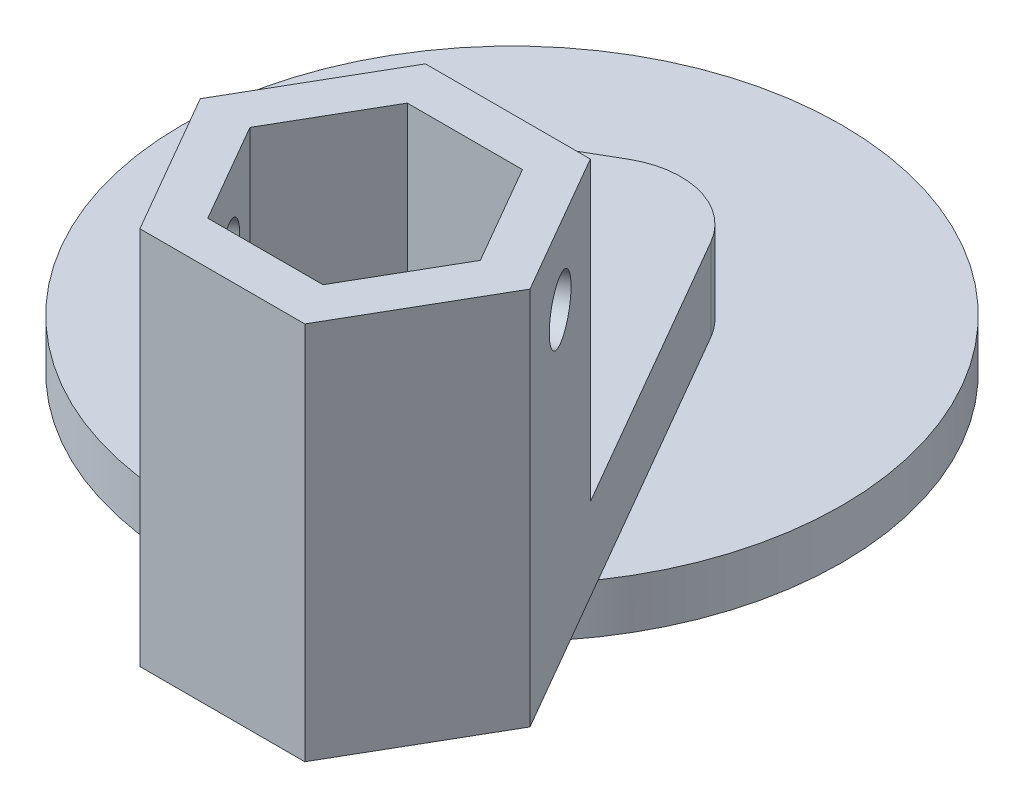
from build123d import *

# Parameters (mm, degrees)
EXTRUDE_3_DEPTH     = 18
SKETCH_2_R          = 1.8
CUT_EXTRUDE_1_DEPTH = 17.325
SKETCH_4_R          = 1.75
EXTRUDE_9_DEPTH     = 5
SKETCH_7_W          = 17.320508076
SKETCH_7_H          = 5
EXTRUDE_10_DEPTH    = 25
FILLET_1_R          = 5
FILLET_2_R          = 5
SKETCH_8_R          = 20
EXTRUDE_11_DEPTH    = 3


with BuildPart() as part:
    # 草图1 → 凸台-拉伸3 (new body)
    with BuildSketch(Plane(origin=(0, 0, 0), x_dir=(1, 0, 0), z_dir=(0, 1, 0))):
        Polygon((10, 0), (5, 8.660254038), (-5, 8.660254038), (-10, 0), (-5, -8.660254038), (5, -8.660254038), align=None)
        Polygon((6.985938257, 0), (3.492969129, 6.05), (-3.492969129, 6.05), (-6.985938257, 0), (-3.492969129, -6.05), (3.492969129, -6.05), align=None, mode=Mode.SUBTRACT)
    extrude(amount=-EXTRUDE_3_DEPTH)

    # 草图2 → 切除-拉伸1 (cut)
    with BuildSketch(Plane(origin=(7.5, 0, -4.330127019), x_dir=(-0.5000000000000003, 0, -0.8660254037844386), z_dir=(0.8660254037844386, 0, -0.5000000000000003))):
        with Locations((0, -4.5)):
            Circle(SKETCH_2_R)
    extrude(amount=-CUT_EXTRUDE_1_DEPTH, mode=Mode.SUBTRACT)

    # 草图4 → 凸台-拉伸9 (add)
    with BuildSketch(Plane.XZ.offset(18)):
        Polygon((-10, 0), (5, -8.660254038), (10, 0), (5, 8.660254038), (-5, 8.660254038), align=None)
        with Locations(Location((0, 0, 0), (0, 0, 270))):
            Circle(SKETCH_4_R, mode=Mode.SUBTRACT)
    extrude(amount=EXTRUDE_9_DEPTH)

    # 草图7 → 凸台-拉伸10 (add)
    with BuildSketch(Plane(origin=(-2.5, 0, -4.330127019), x_dir=(-0.8660254037844388, 0, 0.49999999999999983), z_dir=(-0.4999999999999998, 0, -0.8660254037844387))):
        with Locations((0, -20.5)):
            Rectangle(SKETCH_7_W, SKETCH_7_H)
    extrude(amount=EXTRUDE_10_DEPTH)

    # 圆角1
    fillet_1_edges = [part.edges().sort_by_distance(p)[0] for p in [
        (-7.5, -20.5, -30.310889132),
    ]]
    fillet(fillet_1_edges, radius=FILLET_1_R)

    # 圆角2
    fillet_2_edges = [part.edges().sort_by_distance(p)[0] for p in [
        (-22.5, -20.5, -21.650635095),
    ]]
    fillet(fillet_2_edges, radius=FILLET_2_R)

    # 草图8 → 凸台-拉伸11 (add)
    with BuildSketch(Plane.XZ.offset(23)):
        with Locations(Location((-12.169872981, -21.078838325, 0), (0, 0, 85.658906273))):
            Circle(SKETCH_8_R)
    extrude(amount=EXTRUDE_11_DEPTH)


solid = part.part
